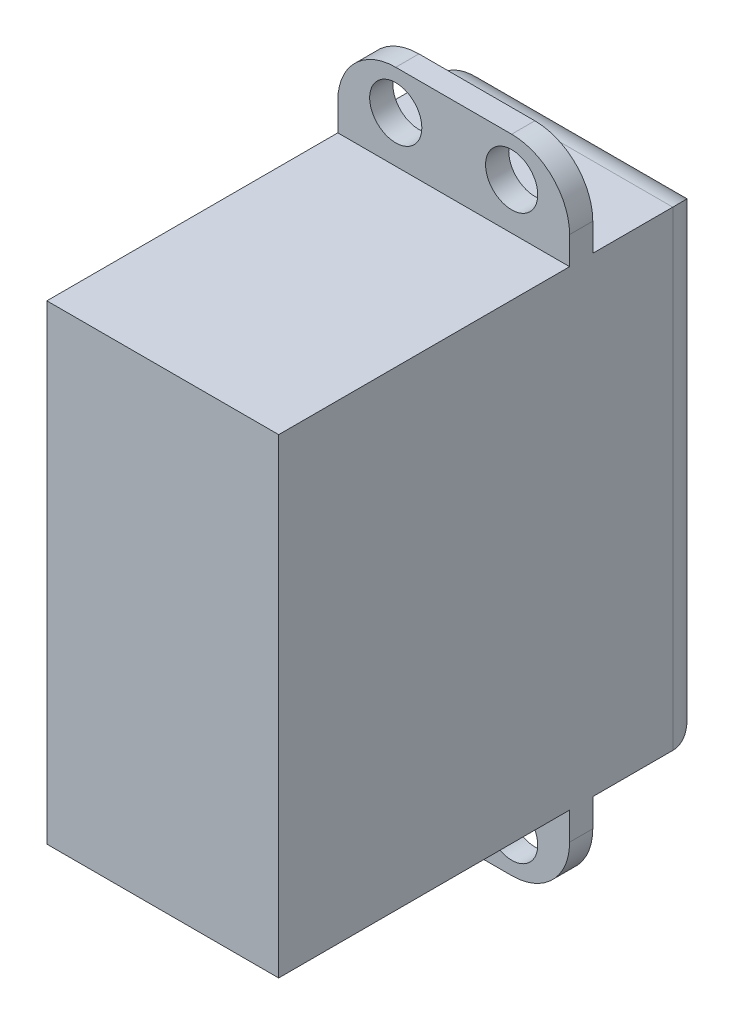
from build123d import *

# Parameters (mm, degrees)
BOSS_EXTRUDE1_DEPTH      = 27.1
BOSS_EXTRUDE1_DEPTH_BACK = 9.9
SKETCH2_W                = 20
SKETCH2_H                = 40.6
SKETCH1_R                = 2.83646338
SKETCH1_R_2              = 2.25
BOSS_EXTRUDE2_DEPTH      = 2
FILLET1_R                = 3
SKETCH3_R                = 3
BOSS_EXTRUDE3_DEPTH      = 5


with BuildPart() as part:
    # Sketch2 → Boss-Extrude1 (new, two sides: drawn at the far end of the back side and taken through both)
    with BuildSketch(Plane.XY.offset(-BOSS_EXTRUDE1_DEPTH_BACK)):
        Rectangle(SKETCH2_W, SKETCH2_H)
    extrude(amount=BOSS_EXTRUDE1_DEPTH + BOSS_EXTRUDE1_DEPTH_BACK)

    # Sketch1 → Boss-Extrude2 (add)
    with BuildSketch(Plane.XY):
        with BuildLine():
            Line((-5, -27.7), (5, -27.7))
            ThreePointArc((5, -27.7), (8.535533906, -26.235533906), (10, -22.7))
            Line((10, -22.7), (10, 22.7))
            ThreePointArc((10, 22.7), (8.535533906, 26.235533906), (5, 27.7))
            Line((5, 27.7), (-5, 27.7))
            ThreePointArc((-5, 27.7), (-8.535533906, 26.235533906), (-10, 22.7))
            Line((-10, 22.7), (-10, -22.7))
            ThreePointArc((-10, -22.7), (-8.535533906, -26.235533906), (-5, -27.7))
        make_face()
        with Locations((0, 9.8)):
            Circle(SKETCH1_R, mode=Mode.SUBTRACT)
        with Locations((-5, 24.3)):
            Circle(SKETCH1_R_2, mode=Mode.SUBTRACT)
        with Locations(Location((5, 24.3, 0), (0, 0, 180))):
            Circle(SKETCH1_R_2, mode=Mode.SUBTRACT)
        with Locations((5, -24.3)):
            Circle(SKETCH1_R_2, mode=Mode.SUBTRACT)
        with Locations(Location((-5, -24.3, 0), (0, 0, 180))):
            Circle(SKETCH1_R_2, mode=Mode.SUBTRACT)
    extrude(amount=BOSS_EXTRUDE2_DEPTH)

    # Fillet1
    fillet1_edges = [part.edges().sort_by_distance(p)[0] for p in [
        (10, 0, -9.9),
        (0, 20.3, -9.9),
        (-10, 0, -9.9),
        (0, -20.3, -9.9),
    ]]
    fillet(fillet1_edges, radius=FILLET1_R)

    # Sketch3 → Boss-Extrude3 (add)
    with BuildSketch(Plane(origin=(0, 0, -9.9), x_dir=(-1, 0, 0), z_dir=(0, 0, -1))):
        with Locations(Location((0, 9.8, 0), (0, 0, 180))):
            Circle(SKETCH3_R)
    extrude(amount=BOSS_EXTRUDE3_DEPTH)


solid = part.part
